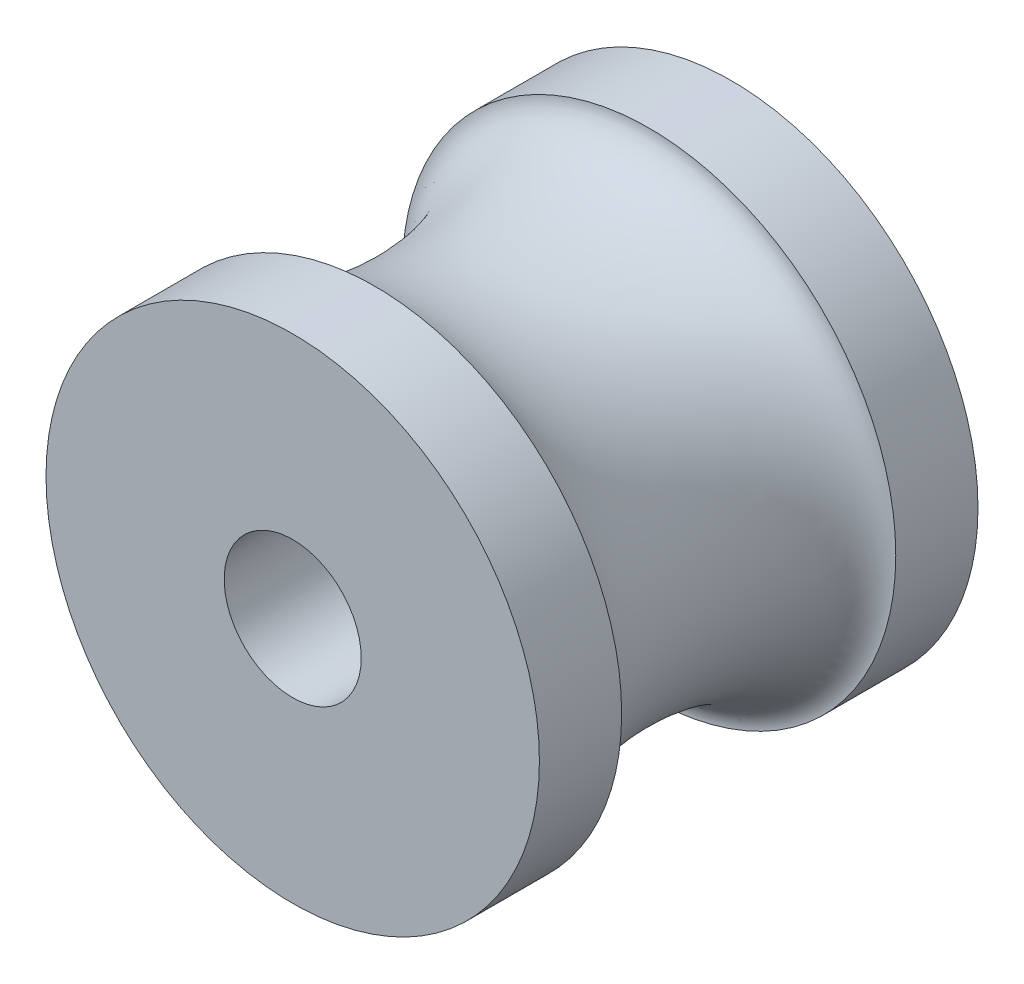
from build123d import *

# Parameters (mm, degrees)
SKETCH1_R           = 9
SKETCH1_R_2         = 2.5
BOSS_EXTRUDE1_DEPTH = 16
SKETCH2_RX          = 5
SKETCH2_RY          = 2


with BuildPart() as part:
    # Sketch1 → Boss-Extrude1 (new body)
    with BuildSketch(Plane.XY):
        Circle(SKETCH1_R)
        Circle(SKETCH1_R_2, mode=Mode.SUBTRACT)
    extrude(amount=BOSS_EXTRUDE1_DEPTH)

    # Sketch2 → Cut-Revolve1 (revolve, cut)
    with BuildSketch(Plane(origin=(0, 0, 0), x_dir=(0, 0, -1), z_dir=(1, 0, 0)), mode=Mode.PRIVATE) as cut_revolve1_sk:
        with Locations(Location((-8, 9), (0, 0, 180))):
            Ellipse(SKETCH2_RX, SKETCH2_RY)
    revolve(cut_revolve1_sk.sketch.rotate(Axis((0, 0, 0), (0, 0, 1)), 90), axis=Axis((0, 0, 0), (0, 0, 1)), mode=Mode.SUBTRACT)


solid = part.part
